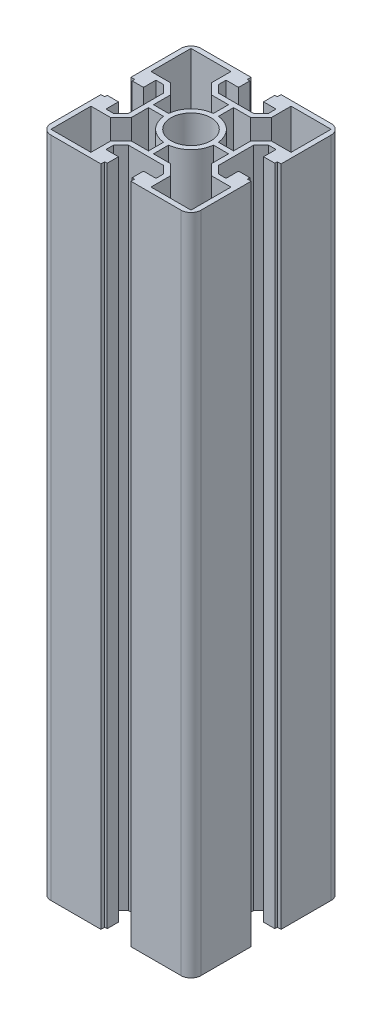
from build123d import *

# Parameters (mm, degrees)
SKETCH_1_R      = 8
EXTRUDE_1_DEPTH = 265


with BuildPart() as part:
    # 草图1 → 凸台-拉伸1 (new body)
    with BuildSketch(Plane(origin=(0, 0, 0), x_dir=(1, 0, 0), z_dir=(0, 1, 0))):
        with BuildLine():
            Line((-30, 5.999999999), (-28.5, 5.999999999))
            Line((-28.5, 5.999999999), (-28.5, 4.999999999))
            Line((-28.5, 4.999999999), (-24, 4.999999999))
            Line((-24, 4.999999999), (-24, 9.999999999))
            Line((-24, 9.999999999), (-21, 9.999999999))
            Line((-21, 9.999999999), (-18, 6.999999999))
            Line((-18, 6.999999999), (-18, -7.000000001))
            Line((-18, -7.000000001), (-21, -10.000000001))
            Line((-21, -10.000000001), (-24, -10.000000001))
            Line((-24, -10.000000001), (-24, -5.000000001))
            Line((-24, -5.000000001), (-28.5, -5.000000001))
            Line((-28.5, -5.000000001), (-28.5, -6.000000001))
            Line((-28.5, -6.000000001), (-30, -6.000000001))
            Line((-30, -6.000000001), (-30, -26.000000001))
            ThreePointArc((-30, -26.000000001), (-28.828427125, -28.828427126), (-26, -30.000000001))
            Line((-26, -30.000000001), (-6, -30.000000001))
            Line((-6, -30.000000001), (-6, -28.500000001))
            Line((-6, -28.500000001), (-5, -28.500000001))
            Line((-5, -28.500000001), (-5, -24.000000001))
            Line((-5, -24.000000001), (-10, -24.000000001))
            Line((-10, -24.000000001), (-10, -21.000000001))
            Line((-10, -21.000000001), (-7, -18.000000001))
            Line((-7, -18.000000001), (7, -18.000000001))
            Line((7, -18.000000001), (10, -21.000000001))
            Line((10, -21.000000001), (10, -24.000000001))
            Line((10, -24.000000001), (5, -24.000000001))
            Line((5, -24.000000001), (5, -28.500000001))
            Line((5, -28.500000001), (6, -28.500000001))
            Line((6, -28.500000001), (6, -30.000000001))
            Line((6, -30.000000001), (26, -30.000000001))
            ThreePointArc((26, -30.000000001), (28.828427125, -28.828427126), (30, -26.000000001))
            Line((30, -26.000000001), (30, -6.000000001))
            Line((30, -6.000000001), (28.5, -6.000000001))
            Line((28.5, -6.000000001), (28.5, -5.000000001))
            Line((28.5, -5.000000001), (24, -5.000000001))
            Line((24, -5.000000001), (24, -10.000000001))
            Line((24, -10.000000001), (21, -10.000000001))
            Line((21, -10.000000001), (18, -7.000000001))
            Line((18, -7.000000001), (18, 6.999999999))
            Line((18, 6.999999999), (21, 9.999999999))
            Line((21, 9.999999999), (24, 9.999999999))
            Line((24, 9.999999999), (24, 4.999999999))
            Line((24, 4.999999999), (28.5, 4.999999999))
            Line((28.5, 4.999999999), (28.5, 5.999999999))
            Line((28.5, 5.999999999), (30, 5.999999999))
            Line((30, 5.999999999), (30, 25.999999999))
            ThreePointArc((30, 25.999999999), (28.828427125, 28.828427124), (26, 29.999999999))
            Line((26, 29.999999999), (6, 29.999999999))
            Line((6, 29.999999999), (6, 28.499999999))
            Line((6, 28.499999999), (5, 28.499999999))
            Line((5, 28.499999999), (5, 23.999999999))
            Line((5, 23.999999999), (10, 23.999999999))
            Line((10, 23.999999999), (10, 20.999999999))
            Line((10, 20.999999999), (7, 17.999999999))
            Line((7, 17.999999999), (-7, 17.999999999))
            Line((-7, 17.999999999), (-10, 20.999999999))
            Line((-10, 20.999999999), (-10, 23.999999999))
            Line((-10, 23.999999999), (-5, 23.999999999))
            Line((-5, 23.999999999), (-5, 28.499999999))
            Line((-5, 28.499999999), (-6, 28.499999999))
            Line((-6, 28.499999999), (-6, 29.999999999))
            Line((-6, 29.999999999), (-26.000000001, 29.999999999))
            ThreePointArc((-26.000000001, 29.999999999), (-28.828427125, 28.828427123), (-30, 25.999999999))
            Line((-30, 25.999999999), (-30, 5.999999999))
        make_face()
        with Locations(Location((0, 0, 0), (0, 0, 270))):
            Circle(SKETCH_1_R, mode=Mode.SUBTRACT)
        with BuildLine():
            Line((-16, 1), (-9.949874371, 1))
            ThreePointArc((-9.949874371, 1), (-7.071067812, 7.071067811), (-1.000000001, 9.949874371))
            Line((-1.000000001, 9.949874371), (-1.000000001, 16))
            Line((-1.000000001, 16), (-7.828427125, 16))
            Line((-7.828427125, 16), (-12, 20.171572875))
            Line((-12, 20.171572875), (-12, 28))
            Line((-12, 28), (-28, 28))
            Line((-28, 28), (-28, 12))
            Line((-28, 12), (-20.171572875, 12))
            Line((-20.171572875, 12), (-16, 7.828427125))
            Line((-16, 7.828427125), (-16, 1))
        make_face(mode=Mode.SUBTRACT)
        with BuildLine():
            Line((1, 9.949874371), (1, 16))
            Line((1, 16), (7.828427125, 16))
            Line((7.828427125, 16), (12, 20.171572875))
            Line((12, 20.171572875), (12, 28))
            Line((12, 28), (28, 28))
            Line((28, 28), (28, 12.000000001))
            Line((28, 12.000000001), (20.171572875, 12.000000001))
            Line((20.171572875, 12.000000001), (16, 7.828427126))
            Line((16, 7.828427126), (16, 1.000000001))
            Line((16, 1.000000001), (9.949874371, 1.000000001))
            ThreePointArc((9.949874371, 1.000000001), (7.071067811, 7.071067812), (1, 9.949874371))
        make_face(mode=Mode.SUBTRACT)
        with BuildLine():
            Line((9.949874371, -1), (16, -1))
            Line((16, -1), (16, -7.828427125))
            Line((16, -7.828427125), (20.171572875, -12))
            Line((20.171572875, -12), (28.000000001, -12))
            Line((28.000000001, -12), (28.000000001, -28))
            Line((28.000000001, -28), (12.000000001, -28))
            Line((12.000000001, -28), (12.000000001, -20.171572875))
            Line((12.000000001, -20.171572875), (7.828427126, -16))
            Line((7.828427126, -16), (1.000000001, -16))
            Line((1.000000001, -16), (1.000000001, -9.949874371))
            ThreePointArc((1.000000001, -9.949874371), (7.071067812, -7.071067811), (9.949874371, -1))
        make_face(mode=Mode.SUBTRACT)
        with BuildLine():
            Line((-1, -9.949874371), (-1, -16.000000001))
            Line((-1, -16.000000001), (-7.828427125, -16.000000001))
            Line((-7.828427125, -16.000000001), (-12, -20.171572876))
            Line((-12, -20.171572876), (-12, -28.000000001))
            Line((-12, -28.000000001), (-28, -28.000000001))
            Line((-28, -28.000000001), (-28, -12.000000001))
            Line((-28, -12.000000001), (-20.171572875, -12.000000001))
            Line((-20.171572875, -12.000000001), (-16, -7.828427126))
            Line((-16, -7.828427126), (-16, -1.000000001))
            Line((-16, -1.000000001), (-9.949874371, -1.000000001))
            ThreePointArc((-9.949874371, -1.000000001), (-7.071067811, -7.071067812), (-1, -9.949874371))
        make_face(mode=Mode.SUBTRACT)
    extrude(amount=EXTRUDE_1_DEPTH)


solid = part.part
